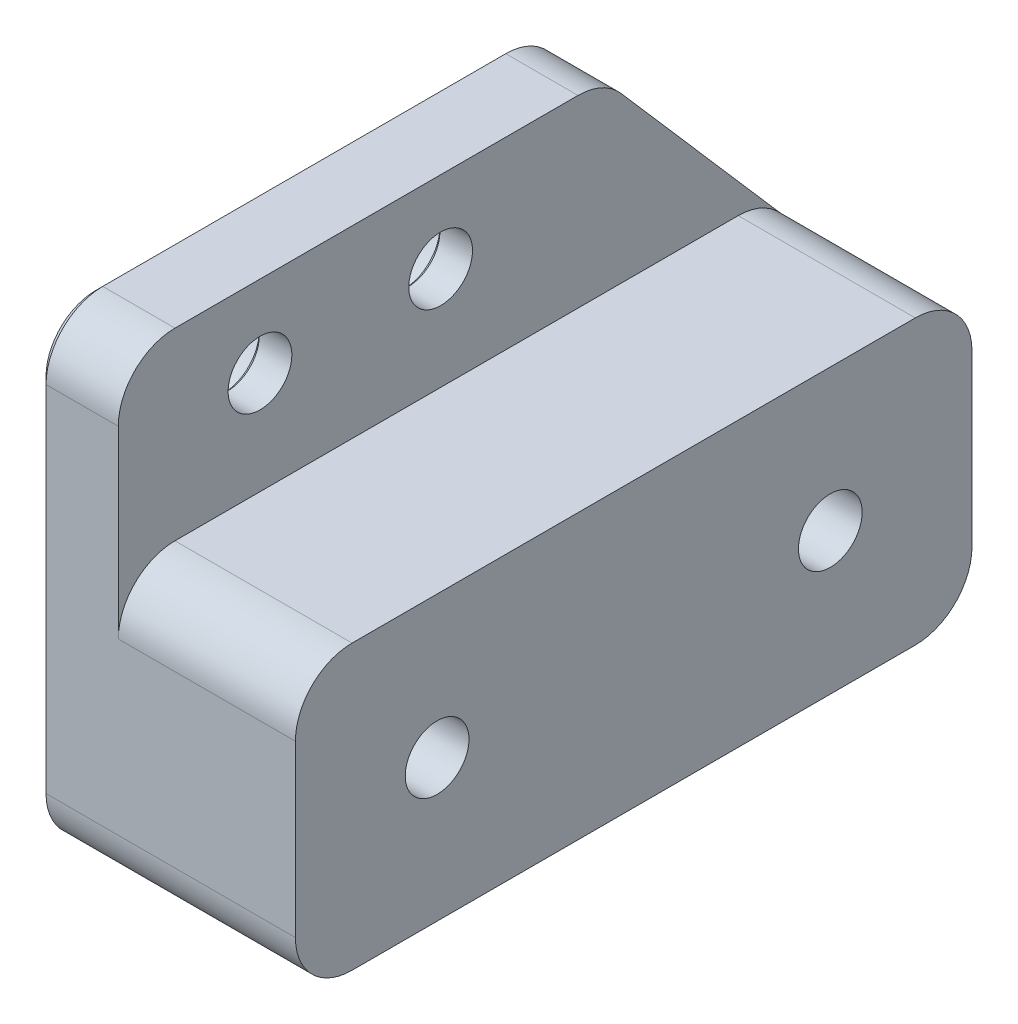
from build123d import *

# Parameters (mm, degrees)
SKETCH1_R           = 2.25
BOSS_EXTRUDE1_DEPTH = 2.6
BOSS_EXTRUDE3_START = -3
SKETCH3_R           = 3.75
BOSS_EXTRUDE3_DEPTH = 3
CHAMFER2_SIZE       = 0.3
CHAMFER3_SIZE       = 0.5
SKETCH4_R           = 2.25
BOSS_EXTRUDE4_DEPTH = 12.5


with BuildPart() as part:
    # Sketch1 → Boss-Extrude1 (new body)
    with BuildSketch(Plane(origin=(0, 0, 0), x_dir=(0, 0, -1), z_dir=(1, 0, 0))):
        with BuildLine():
            Line((-6, -10), (33.75, -10))
            ThreePointArc((33.75, -10), (36.578427125, -8.828427125), (37.75, -6))
            Line((37.75, -6), (37.75, 6))
            ThreePointArc((37.75, 6), (37.496577662, 7.401126626), (36.768422089, 8.62471486))
            Line((36.768422089, 8.62471486), (25.464074263, 21.62471486))
            ThreePointArc((25.464074263, 21.62471486), (24.104136506, 22.63997661), (22.445652174, 23))
            Line((22.445652174, 23), (-6, 23))
            ThreePointArc((-6, 23), (-8.828427125, 21.828427125), (-10, 19))
            Line((-10, 19), (-10, -6))
            ThreePointArc((-10, -6), (-8.828427125, -8.828427125), (-6, -10))
        make_face()
        with Locations((27.75, 0)):
            Circle(SKETCH1_R, mode=Mode.SUBTRACT)
        with Locations((0, 17.25)):
            Circle(SKETCH1_R, mode=Mode.SUBTRACT)
        Circle(SKETCH1_R, mode=Mode.SUBTRACT)
        with Locations((12.75, 17.25)):
            Circle(SKETCH1_R, mode=Mode.SUBTRACT)
    extrude(amount=BOSS_EXTRUDE1_DEPTH)

    # Sketch3 → Boss-Extrude3 (add)
    with BuildSketch(Plane(origin=(0, 0, 0), x_dir=(0, 0, -1), z_dir=(1, 0, 0)).offset(BOSS_EXTRUDE3_START)):
        with BuildLine():
            Line((-6, -10), (33.75, -10))
            ThreePointArc((33.75, -10), (36.578427125, -8.828427125), (37.75, -6))
            Line((37.75, -6), (37.75, 6))
            ThreePointArc((37.75, 6), (37.496577662, 7.401126626), (36.768422089, 8.62471486))
            Line((36.768422089, 8.62471486), (25.464074263, 21.62471486))
            ThreePointArc((25.464074263, 21.62471486), (24.104136506, 22.63997661), (22.445652174, 23))
            Line((22.445652174, 23), (-6, 23))
            ThreePointArc((-6, 23), (-8.828427125, 21.828427125), (-10, 19))
            Line((-10, 19), (-10, -6))
            ThreePointArc((-10, -6), (-8.828427125, -8.828427125), (-6, -10))
        make_face()
        with Locations((27.75, 0)):
            Circle(SKETCH3_R, mode=Mode.SUBTRACT)
        Circle(SKETCH3_R, mode=Mode.SUBTRACT)
        with Locations((0, 17.25)):
            Circle(SKETCH3_R, mode=Mode.SUBTRACT)
        with Locations((12.75, 17.25)):
            Circle(SKETCH3_R, mode=Mode.SUBTRACT)
    extrude(amount=BOSS_EXTRUDE3_DEPTH)

    # Chamfer2
    chamfer2_edges = [part.edges().sort_by_distance(p)[0] for p in [
        (0, 0, -25.5),
        (0, 17.25, 2.25),
        (0, 0, 2.25),
        (0, 17.25, -10.5),
        (0, 0, -24),
        (0, 0, 3.75),
        (0, 17.25, 3.75),
        (0, 17.25, -9),
    ]]
    chamfer(chamfer2_edges, length=CHAMFER2_SIZE)

    # Chamfer3
    chamfer3_edges = [part.edges().sort_by_distance(p)[0] for p in [
        (-3, -8.828427125, 8.828427125),
        (-3, 6.5, 10),
        (-3, 21.828427125, 8.828427125),
        (-3, 23, -8.222826087),
        (-3, 22.63997661, -24.104136506),
        (-3, 15.12471486, -31.116248176),
        (-3, 7.401126626, -37.496577662),
        (-3, 0, -37.75),
        (-3, -8.828427125, -36.578427125),
        (-3, -10, -13.875),
        (-3, 17.25, -9),
        (-3, 17.25, 3.75),
        (-3, 0, 3.75),
        (-3, 0, -24),
    ]]
    chamfer(chamfer3_edges, length=CHAMFER3_SIZE)

    # Sketch4 → Boss-Extrude4 (add)
    with BuildSketch(Plane(origin=(2.6, 0, 0), x_dir=(0, 0, -1), z_dir=(1, 0, 0))):
        with BuildLine():
            Line((-6, -10), (33.75, -10))
            ThreePointArc((33.75, -10), (36.578427125, -8.828427125), (37.75, -6))
            Line((37.75, -6), (37.75, 6))
            ThreePointArc((37.75, 6), (36.578427125, 8.828427125), (33.75, 10))
            Line((33.75, 10), (-6, 10))
            ThreePointArc((-6, 10), (-8.828427125, 8.828427125), (-10, 6))
            Line((-10, 6), (-10, -6))
            ThreePointArc((-10, -6), (-8.828427125, -8.828427125), (-6, -10))
        make_face()
        Circle(SKETCH4_R, mode=Mode.SUBTRACT)
        with Locations((27.75, 0)):
            Circle(SKETCH4_R, mode=Mode.SUBTRACT)
    extrude(amount=BOSS_EXTRUDE4_DEPTH)


solid = part.part
